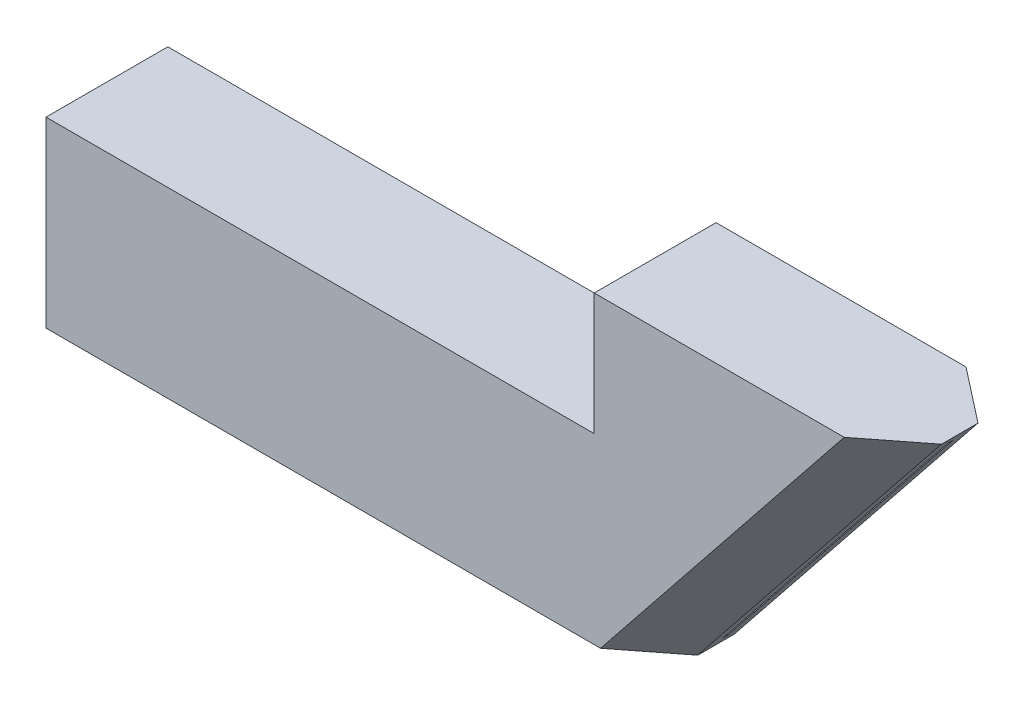
from build123d import *

# Parameters (mm, degrees)
BOSS_EXTRUDE1_DEPTH = 50.8
CHAMFER2_SIZE       = 17.78
CHAMFER3_SIZE       = 17.78
SKETCH8_W           = 2.032
SKETCH8_H           = 149.939355631
CUT_EXTRUDE3_DEPTH  = 6.35


with BuildPart() as part:
    # Sketch6 → Boss-Extrude1 (new body)
    with BuildSketch(Plane.XY):
        Polygon((0, 0), (0, 76.2), (228.6, 76.2), (228.6, 127), (355.6, 127), (254, 0), align=None)
    extrude(amount=BOSS_EXTRUDE1_DEPTH)

    # Chamfer2
    chamfer2_edges = [part.edges().sort_by_distance(p)[0] for p in [
        (304.8, 63.5, 50.8),
    ]]
    chamfer(chamfer2_edges, length=CHAMFER2_SIZE)

    # Chamfer3
    chamfer3_edges = [part.edges().sort_by_distance(p)[0] for p in [
        (304.8, 63.5, 0),
    ]]
    chamfer(chamfer3_edges, length=CHAMFER3_SIZE)

    # Sketch8 → Cut-Extrude3 (cut)
    with BuildSketch(Plane(origin=(154.87804878, -123.902439024, 0), x_dir=(0, 0, -1), z_dir=(0.7808688094430302, -0.6246950475544245, 0))):
        with Locations((-25.4, 239.992219895)):
            Rectangle(SKETCH8_W, SKETCH8_H)
    extrude(amount=-CUT_EXTRUDE3_DEPTH, mode=Mode.SUBTRACT)


solid = part.part
